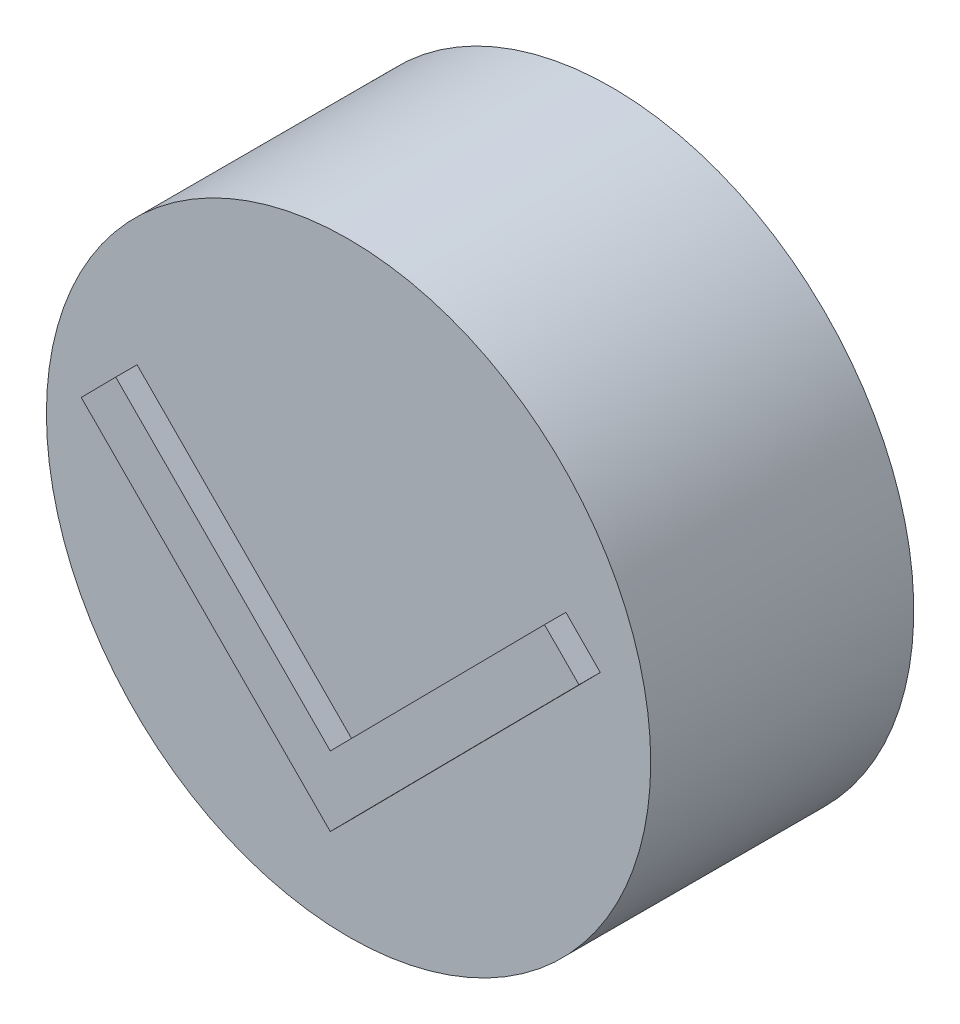
from build123d import *

# Parameters (mm, degrees)
SKETCH1_R           = 8.5
BOSS_EXTRUDE1_DEPTH = 4.4
SKETCH3_R           = 5.8
CUT_EXTRUDE1_DEPTH  = 4
BOSS_EXTRUDE3_START = 3
SKETCH4_R           = 8.5
SKETCH4_R_2         = 7.5
BOSS_EXTRUDE3_DEPTH = 3
BOSS_EXTRUDE4_DEPTH = 0.6


with BuildPart() as part:
    # Sketch1 → Boss-Extrude1 (new body)
    with BuildSketch(Plane.XY):
        Circle(SKETCH1_R)
    extrude(amount=BOSS_EXTRUDE1_DEPTH)

    # Sketch3 → Cut-Extrude1 (cut)
    with BuildSketch(Plane(origin=(0, 0, 0), x_dir=(-1, 0, 0), z_dir=(0, 0, -1))):
        Circle(SKETCH3_R)
    extrude(amount=-CUT_EXTRUDE1_DEPTH, mode=Mode.SUBTRACT)

    # Sketch4 → Boss-Extrude3 (add)
    with BuildSketch(Plane(origin=(0, 0, 0), x_dir=(-1, 0, 0), z_dir=(0, 0, -1)).offset(BOSS_EXTRUDE3_START)):
        Circle(SKETCH4_R)
        Circle(SKETCH4_R_2, mode=Mode.SUBTRACT)
    extrude(amount=-BOSS_EXTRUDE3_DEPTH)

    # Sketch6 → Cut-Revolve1 (revolve, cut)
    with BuildSketch(Plane(origin=(0, 0, 0), x_dir=(1, 0, 0), z_dir=(0, 1, 0)), mode=Mode.PRIVATE) as cut_revolve1_sk:
        Polygon((7.5, 0), (5.8, -1.7), (5.8, 0), align=None)
    revolve(cut_revolve1_sk.sketch.rotate(Axis((0, 0, -5.5), (0, 0, 1)), 180), axis=Axis((0, 0, -5.5), (0, 0, 1)), mode=Mode.SUBTRACT)

    # Sketch2 → Boss-Extrude4 (add)
    with BuildSketch(Plane.XY.offset(4.4)):
        Polygon((0.086062041, -5.591622222), (-6.919546933, 1.481294445), (-5.949194369, 2.462864958), (0.086062041, -3.628481196), (6.11290499, 2.462864958), (7.080453067, 1.481294445), align=None)
    extrude(amount=BOSS_EXTRUDE4_DEPTH)


solid = part.part
